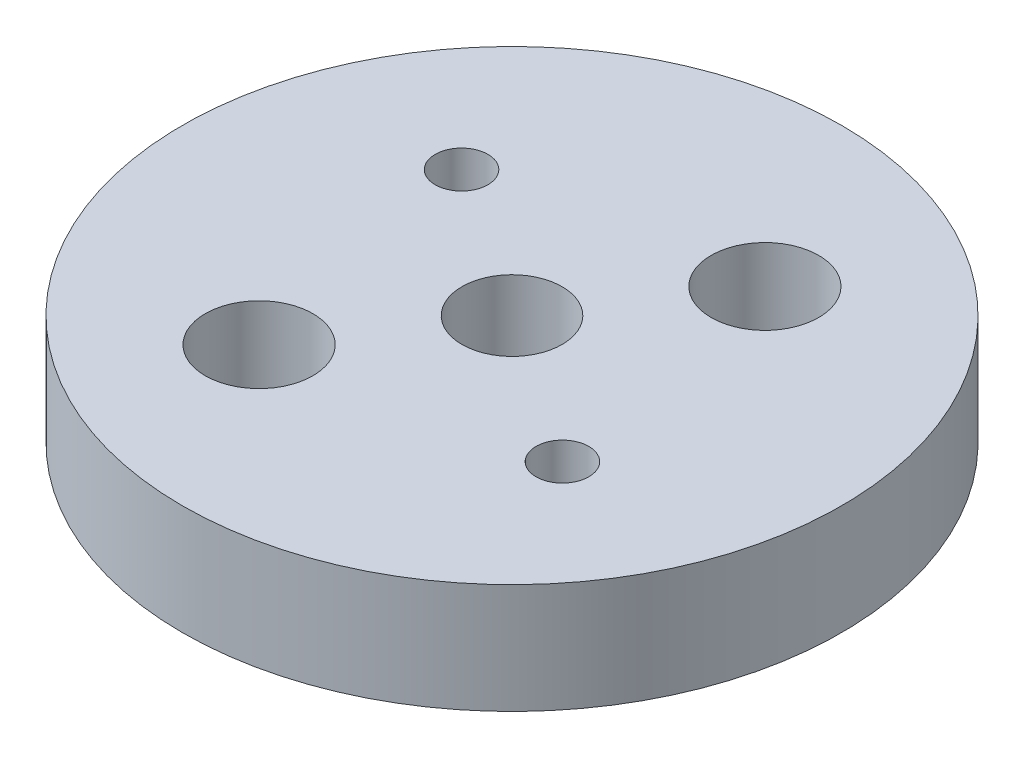
from build123d import *

# Parameters (mm, degrees)
SKETCH1_R           = 19.05
SKETCH1_R_2         = 2.8956
SKETCH1_R_3         = 1.524
SKETCH1_R_4         = 3.1115
BOSS_EXTRUDE1_DEPTH = 6.35


with BuildPart() as part:
    # Sketch1 → Boss-Extrude1 (new body)
    with BuildSketch(Plane(origin=(0, 0, 0), x_dir=(1, 0, 0), z_dir=(0, 1, 0))):
        with Locations(Location((0, 0, 0), (0, 0, 270))):
            Circle(SKETCH1_R)
        with Locations(Location((0, 0, 0), (0, 0, 270))):
            Circle(SKETCH1_R_2, mode=Mode.SUBTRACT)
        with Locations(Location((8.767286662, -5.852124877, 0), (0, 0, 270))):
            Circle(SKETCH1_R_3, mode=Mode.SUBTRACT)
        with Locations(Location((-8.767286662, 5.852124877, 0), (0, 0, 270))):
            Circle(SKETCH1_R_3, mode=Mode.SUBTRACT)
        with Locations(Location((5.852124877, 8.767286662, 0), (0, 0, 270))):
            Circle(SKETCH1_R_4, mode=Mode.SUBTRACT)
        with Locations(Location((-5.852124877, -8.767286662, 0), (0, 0, 270))):
            Circle(SKETCH1_R_4, mode=Mode.SUBTRACT)
    extrude(amount=BOSS_EXTRUDE1_DEPTH)


solid = part.part
